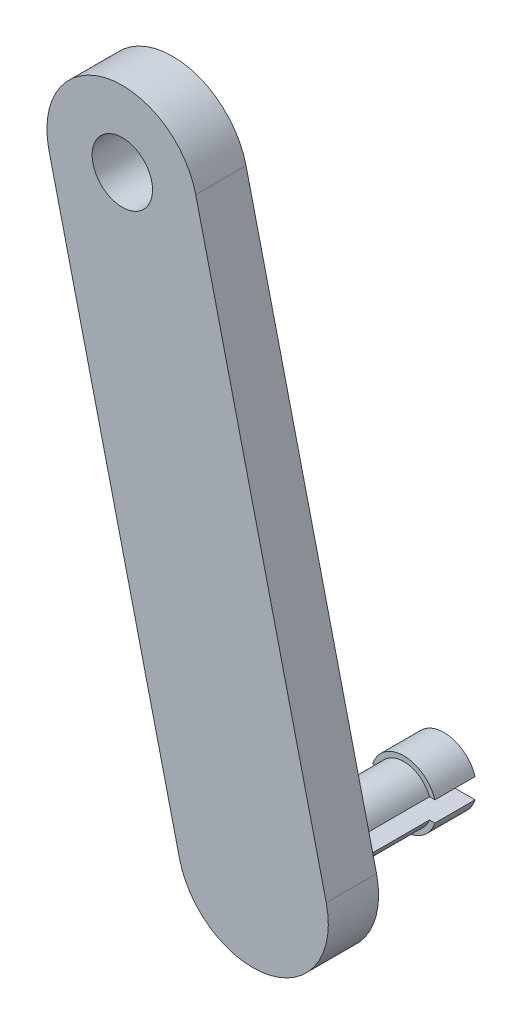
from build123d import *

# Parameters (mm, degrees)
BOSS_EXTRU_1_DEPTH      = 5
ESQUISSE2_R             = 2.75
BOSS_EXTRU_2_DEPTH      = 15
ESQUISSE4_R             = 3.25
BOSS_EXTRU_3_DEPTH      = 4
ESQUISSE5_W             = 10
ESQUISSE5_H             = 2
ENL_V_MAT_EXTRU_2_DEPTH = 14
ESQUISSE6_R             = 3
ENL_V_MAT_EXTRU_3_DEPTH = 14


with BuildPart() as part:
    # Esquisse1 → Boss.-Extru.1 (new body)
    with BuildSketch(Plane.XY):
        with BuildLine():
            Line((-56.704090657, -2.262269623), (-43.729037177, -56.738392716))
            ThreePointArc((-43.729037177, -56.738392716), (-49.287216143, -65.772032435), (-58.320855862, -60.213853469))
            Line((-58.320855862, -60.213853469), (-71.295909343, -5.737730377))
            ThreePointArc((-71.295909343, -5.737730377), (-65.737730377, 3.295909343), (-56.704090657, -2.262269623))
        make_face()
    extrude(amount=BOSS_EXTRU_1_DEPTH)

    # Esquisse2 → Boss.-Extru.2 (add)
    with BuildSketch(Plane.XY.offset(5)):
        with Locations((-51.024946519, -58.476123092)):
            Circle(ESQUISSE2_R)
    extrude(amount=-BOSS_EXTRU_2_DEPTH)

    # Esquisse4 → Boss.-Extru.3 (add)
    with BuildSketch(Plane(origin=(0, 0, -10), x_dir=(-1, 0, 0), z_dir=(0, 0, -1))):
        with Locations((51.024946519, -58.476123092)):
            Circle(ESQUISSE4_R)
    extrude(amount=BOSS_EXTRU_3_DEPTH)

    # Esquisse5 → Enlèv. mat.-Extru.2 (cut)
    with BuildSketch(Plane(origin=(0, 0, -14), x_dir=(-1, 0, 0), z_dir=(0, 0, -1))):
        with Locations((51.024946519, -58.476123092)):
            Rectangle(ESQUISSE5_W, ESQUISSE5_H)
    extrude(amount=-ENL_V_MAT_EXTRU_2_DEPTH, mode=Mode.SUBTRACT)

    # Esquisse6 → Enlèv. mat.-Extru.3 (cut)
    with BuildSketch(Plane.XY.offset(5)):
        with Locations((-64, -4)):
            Circle(ESQUISSE6_R)
    extrude(amount=-ENL_V_MAT_EXTRU_3_DEPTH, mode=Mode.SUBTRACT)


solid = part.part
